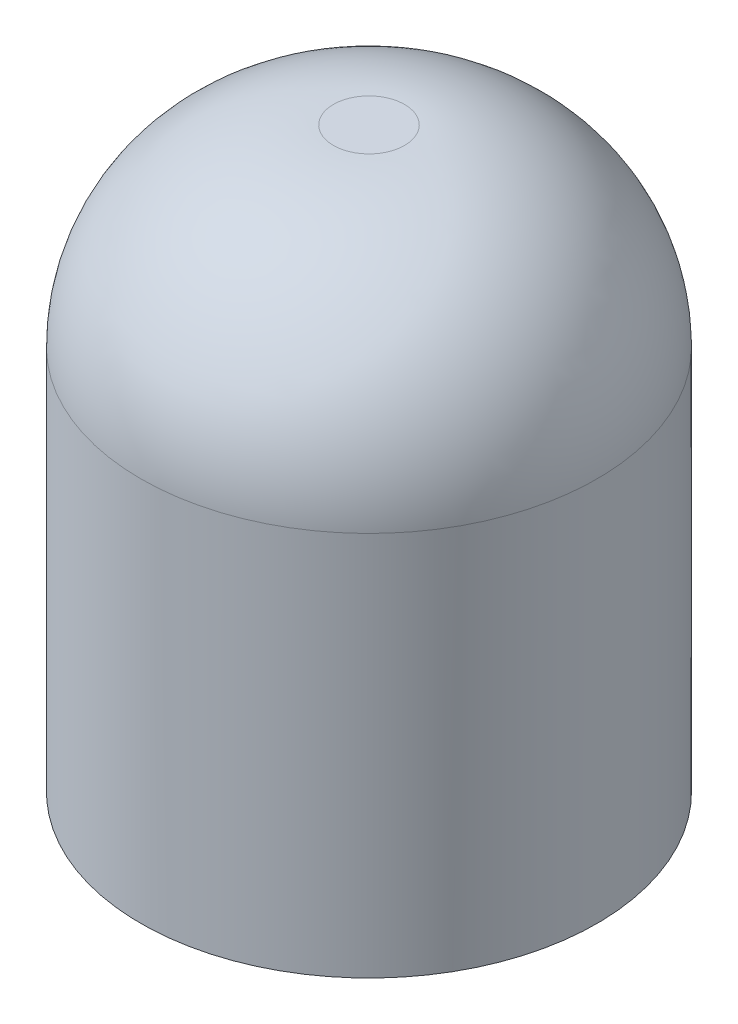
from build123d import *

# Parameters (mm, degrees)
SKETCH1_R           = 30.091373625
BOSS_EXTRUDE1_DEPTH = 76.2
FILLET2_R           = 25.4


with BuildPart() as part:
    # Sketch1 → Boss-Extrude1 (new body)
    with BuildSketch(Plane(origin=(0, 0, 0), x_dir=(1, 0, 0), z_dir=(0, 1, 0))):
        with Locations(Location((0, 0, 0), (0, 0, 90))):
            Circle(SKETCH1_R)
    extrude(amount=BOSS_EXTRUDE1_DEPTH)

    # Fillet2
    fillet2_edges = [part.edges().sort_by_distance(p)[0] for p in [
        (0, 76.2, 30.091373625),
    ]]
    fillet(fillet2_edges, radius=FILLET2_R)


solid = part.part
